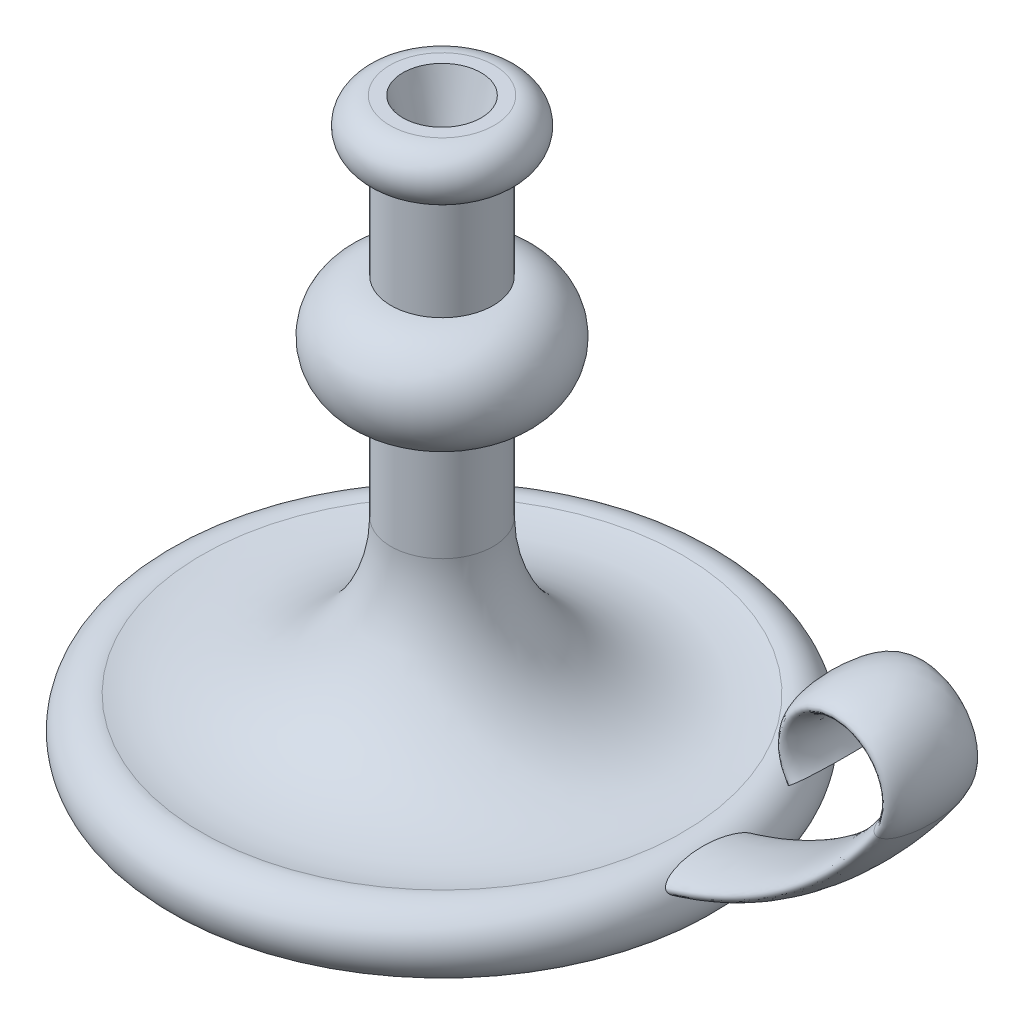
from build123d import *

# Parameters (mm, degrees)
SKETCH_3_RX         = 17.5
SKETCH_3_RY         = 5
SKETCH_5_R          = 15
CUT_EXTRUDE_1_DEPTH = 25
CUT_EXTRUDE_1_DRAFT = -15


with BuildPart() as part:
    # 草圖1 → 旋轉1 (revolve)
    with BuildSketch(Plane.XY, mode=Mode.PRIVATE) as revolve_1_sk:
        with BuildLine():
            Line((0, 0), (0, 220))
            Line((0, 220), (20, 220))
            ThreePointArc((20, 220), (29.997984476, 209.799235428), (19.598551784, 200.008061283))
            Line((19.598551784, 200.008061283), (19.598551784, 160.008061283))
            ThreePointArc((19.598551784, 160.008061283), (39.598551784, 140.008061283), (19.598551784, 120.008061283))
            Line((19.598551784, 120.008061283), (19.598551784, 80.008061283))
            ThreePointArc((19.598551784, 80.008061283), (41.867791383, 33.356269039), (92.144875769, 21.334474768))
            ThreePointArc((92.144875769, 21.334474768), (105.832262375, 14.909609682), (103.316912972, 0))
            Line((103.316912972, 0), (0, 0))
        make_face()
    revolve(revolve_1_sk.sketch.rotate(Axis((0, 0, 0), (0, 1, 0)), 90), axis=Axis((0, 0, 0), (0, 1, 0)))

    # 掃出1: sweep along a path in 草圖2
    with BuildLine(Plane.XY) as sweep_1_path:
        Line((0, 10), (60, 10))
        ThreePointArc((60, 10), (129.821200219, 27.240819526), (183.592070943, 75))
        ThreePointArc((183.592070943, 75), (167.113128151, 106.333333333), (150.634185358, 75))
    # 草圖3 → 掃出1 (sweep)
    with BuildSketch(Plane(origin=(0, 0, 0), x_dir=(0, 0, -1), z_dir=(1, 0, 0))):
        with Locations((0, 10)):
            Ellipse(SKETCH_3_RX, SKETCH_3_RY)
    sweep(path=sweep_1_path.line)


with BuildPart() as cut_extrude_1_tool:
    # 草圖5 → 除料-伸長1 (with draft: the straight prism first)
    with BuildSketch(Plane(origin=(0, 220, 0), x_dir=(1, 0, 0), z_dir=(0, 1, 0))):
        Circle(SKETCH_5_R)
    extrude(amount=-CUT_EXTRUDE_1_DEPTH)
    # 除料-伸長1: the draft: its side faces are tilted about the plane it starts from
    cut_extrude_1_sides = [cut_extrude_1_tool.faces().sort_by_distance(p)[0] for p in [
        (-15, 207.5, 0),
    ]]
    draft(cut_extrude_1_sides, Plane(origin=(0, 220, 0), x_dir=(1, 0, 0), z_dir=(0, 1, 0)), CUT_EXTRUDE_1_DRAFT)


with BuildPart() as part_1:
    add(part.part)

    # 除料-伸長1: cut by cut_extrude_1_tool
    add(cut_extrude_1_tool.part, mode=Mode.SUBTRACT)


solid = part_1.part
